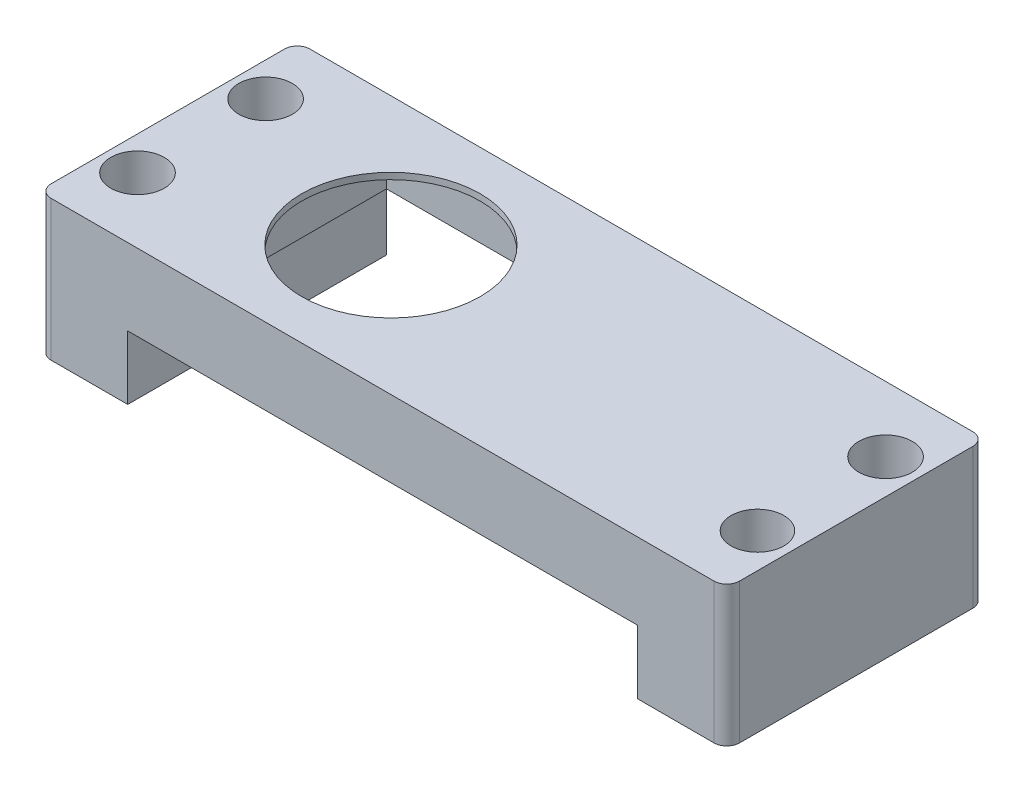
from build123d import *

# Parameters (mm, degrees)
SKETCH1_W               = 40
SKETCH1_H               = 20.3
BOSS_EXTRUDE3_DEPTH     = 6
SHELL1_T                = -0.5
SKETCH4_W               = 7
SKETCH4_H               = 20.3
BOSS_EXTRUDE4_DEPTH     = 11
FILLET1_R               = 1
SKETCH5_R               = 2.1
SKETCH5_R_2             = 2.070075265
CUT_EXTRUDE3_DEPTH      = 6
SKETCH7_R               = 7
CUT_EXTRUDE4_DEPTH      = 88
CUT_EXTRUDE5_DEPTH      = 30.462221573
CUT_EXTRUDE5_DEPTH_BACK = 30.462221573
SKETCH8_R               = 2.1
SKETCH8_R_2             = 2.070075265


with BuildPart() as part:
    # Sketch1 → Boss-Extrude3 (new body)
    with BuildSketch(Plane(origin=(0, 0, 0), x_dir=(1, 0, 0), z_dir=(0, 1, 0))):
        Rectangle(SKETCH1_W, SKETCH1_H)
    extrude(amount=BOSS_EXTRUDE3_DEPTH)

    # Shell1
    shell1_openings = [part.faces().sort_by_distance(p)[0] for p in [
        (0, 0, 0),
    ]]
    offset(amount=SHELL1_T, openings=shell1_openings, kind=Kind.INTERSECTION)

    # Sketch4 → Boss-Extrude4 (add)
    with BuildSketch(Plane(origin=(0, 6, 0), x_dir=(1, 0, 0), z_dir=(0, 1, 0))):
        with Locations((-23.5, 0)):
            Rectangle(SKETCH4_W, SKETCH4_H)
        with Locations((23.5, 0)):
            Rectangle(SKETCH4_W, SKETCH4_H)
    extrude(amount=-BOSS_EXTRUDE4_DEPTH)

    # Fillet1
    fillet1_edges = [part.edges().sort_by_distance(p)[0] for p in [
        (-27, 0.5, 10.15),
        (-27, 0.5, -10.15),
        (27, 0.5, -10.15),
        (27, 0.5, 10.15),
    ]]
    fillet(fillet1_edges, radius=FILLET1_R)

    # Sketch5 → Cut-Extrude3 (cut)
    with BuildSketch(Plane.XZ.offset(5)):
        with Locations(Location((-24.35750849, 5.025, 0), (0, 0, 270))):
            Circle(SKETCH5_R)
        with Locations(Location((-24.35750849, -5.025, 0), (0, 0, 270))):
            Circle(SKETCH5_R)
        with Locations(Location((24.284171764, 5.025, 0), (0, 0, 270))):
            Circle(SKETCH5_R_2)
        with Locations(Location((24.284171764, -5.025, 0), (0, 0, 270))):
            Circle(SKETCH5_R)
    extrude(amount=-CUT_EXTRUDE3_DEPTH, mode=Mode.SUBTRACT)

    # Sketch7 → Cut-Extrude4 (cut)
    with BuildSketch(Plane.XZ.offset(-5.5)):
        with Locations(Location((-9.5, 0, 0), (0, 0, 270))):
            Circle(SKETCH7_R)
    extrude(amount=-CUT_EXTRUDE4_DEPTH, mode=Mode.SUBTRACT)

    # Sketch8 → Cut-Extrude5 (cut, two sides: drawn at the far end of the back side and taken through both)
    with BuildSketch(Plane.XZ.offset(-1).offset(-CUT_EXTRUDE5_DEPTH_BACK)):
        with Locations(Location((24.284171764, -5.025, 0), (0, 0, 270))):
            Circle(SKETCH8_R)
        with Locations(Location((24.284171764, 5.025, 0), (0, 0, 270))):
            Circle(SKETCH8_R_2)
        with Locations(Location((-24.35750849, 5.025, 0), (0, 0, 270))):
            Circle(SKETCH8_R)
        with Locations(Location((-24.35750849, -5.025, 0), (0, 0, 270))):
            Circle(SKETCH8_R)
    extrude(amount=CUT_EXTRUDE5_DEPTH + CUT_EXTRUDE5_DEPTH_BACK, mode=Mode.SUBTRACT)


solid = part.part
